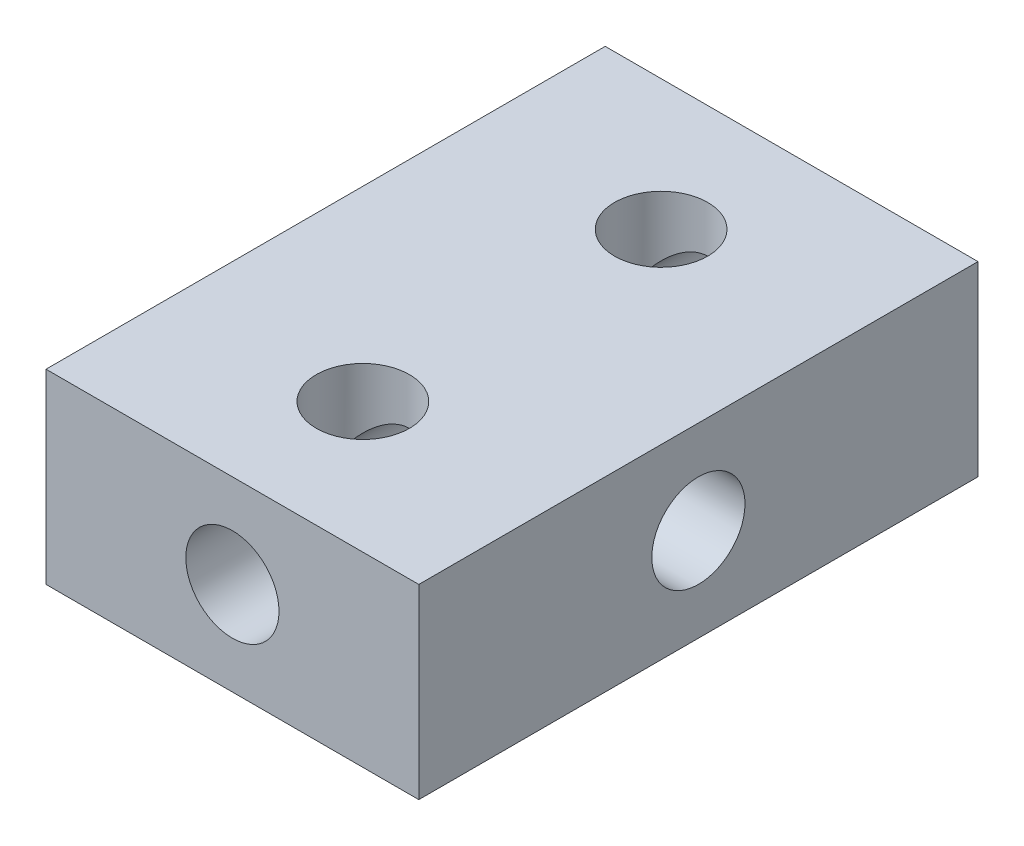
from build123d import *

# Parameters (mm, degrees)
ESQUISSE1_W       = 10
ESQUISSE1_H       = 5
EXTRUSION1_DEPTH  = 15
TROU_TARAUD_M31_D = 2.5
TROU_TARAUD_M32_D = 2.5
TROU_TARAUD_M33_D = 2.5


with BuildPart() as part:
    # Esquisse1 → Extrusion1 (new body)
    with BuildSketch(Plane.XY):
        with Locations((5, 2.5)):
            Rectangle(ESQUISSE1_W, ESQUISSE1_H)
    extrude(amount=EXTRUSION1_DEPTH)

    # Trou taraudé M31 (through all)
    with Locations(Plane.XY.offset(15)):
        with Locations((5, 2.5)):
            Hole(TROU_TARAUD_M31_D / 2)

    # Trou taraudé M32 (through all)
    with Locations(Plane(origin=(10, 0, 0), x_dir=(0, 0, -1), z_dir=(1, 0, 0))):
        with Locations((-7.5, 2.5)):
            Hole(TROU_TARAUD_M32_D / 2)

    # Trou taraudé M33 (through all)
    with Locations(Plane(origin=(0, 5, 0), x_dir=(-1, 0, 0), z_dir=(0, 1, 0))):
        with Locations((-5, 11.5), (-5, 3.5)):
            Hole(TROU_TARAUD_M33_D / 2)


solid = part.part
